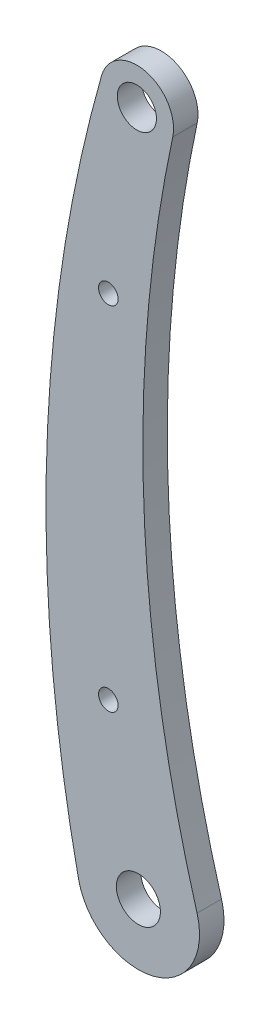
from build123d import *

# Parameters (mm, degrees)
SCHIZZO1_R                   = 4.5
SCHIZZO1_R_2                 = 4
ESTRUSIONE_ESTRUSIONE1_DEPTH = 5
SCHIZZO2_R                   = 2
TAGLIO_ESTRUSIONE1_DEPTH     = 25


with BuildPart() as part:
    # Schizzo1 → Estrusione-Estrusione1 (new body)
    with BuildSketch(Plane.XY):
        with BuildLine():
            ThreePointArc((7.023974797, 138.427683332), (1.499753731, 147.278176914), (-7.525391936, 142.044153534))
            ThreePointArc((-7.525391936, 142.044153534), (-18.729107246, 69.99949188), (-12.22229981, -2.620188418))
            ThreePointArc((-12.22229981, -2.620188418), (3.068449146, -12.117533571), (11.996332959, 3.512548298))
            ThreePointArc((11.996332959, 3.512548298), (1.102237583, 70.660238267), (7.023974797, 138.427683332))
        make_face()
        Circle(SCHIZZO1_R, mode=Mode.SUBTRACT)
        with Locations((-0.309434746, 139.999658036)):
            Circle(SCHIZZO1_R_2, mode=Mode.SUBTRACT)
    extrude(amount=ESTRUSIONE_ESTRUSIONE1_DEPTH)

    # Schizzo2 → Taglio-Estrusione1 (cut)
    with BuildSketch(Plane.XY.offset(5)):
        with Locations((-6.142115432, 104.166670735)):
            Circle(SCHIZZO2_R)
        with Locations((-6.142115432, 32.213749463)):
            Circle(SCHIZZO2_R)
    extrude(amount=-TAGLIO_ESTRUSIONE1_DEPTH, mode=Mode.SUBTRACT)


solid = part.part
